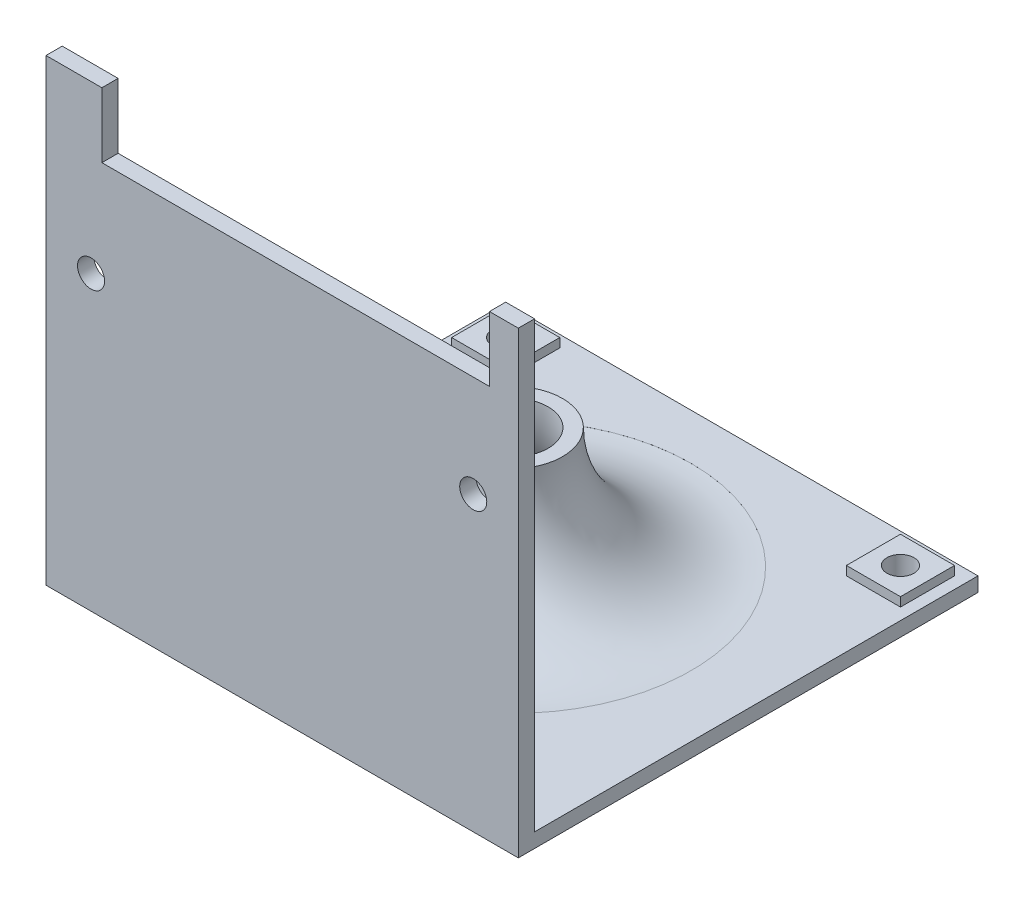
from build123d import *

# Parameters (mm, degrees)
SKETCH2_W           = 52.4
SKETCH2_H           = 51
SKETCH2_R           = 19.896881497
BOSS_EXTRUDE1_DEPTH = 1.6
SKETCH3_W           = 52.4
SKETCH3_H           = 1.8
BOSS_EXTRUDE2_DEPTH = 49.3
SKETCH4_W           = 6
SKETCH4_H           = 6
BOSS_EXTRUDE3_DEPTH = 1
SKETCH5_R           = 1.5
CUT_EXTRUDE1_DEPTH  = 62.006393108
SKETCH6_R           = 1.5
SKETCH6_W           = 43
SKETCH6_H           = 7.2
CUT_EXTRUDE2_DEPTH  = 77.842045782


with BuildPart() as part:
    # Sketch1 → Revolve1 (revolve)
    with BuildSketch(Plane.XY, mode=Mode.PRIVATE) as revolve1_sk:
        with BuildLine():
            Line((4, 15), (5.6, 15))
            ThreePointArc((5.6, 15), (9.845065713, 5.201403427), (19.896881497, 1.596673597))
            Line((19.896881497, 1.596673597), (20, 0))
            ThreePointArc((20, 0), (8.750759907, 4.0341439), (4, 15))
        make_face()
    revolve(revolve1_sk.sketch.rotate(Axis((0, 0, 0), (0, 1, 0)), 90), axis=Axis((0, 0, 0), (0, 1, 0)))

    # Sketch2 → Boss-Extrude1 (add)
    with BuildSketch(Plane(origin=(0, 0, 0), x_dir=(1, 0, 0), z_dir=(0, 1, 0))):
        with Locations((0.5, -0.5)):
            Rectangle(SKETCH2_W, SKETCH2_H)
        with Locations(Location((0, 0, 0), (0, 0, 90))):
            Circle(SKETCH2_R, mode=Mode.SUBTRACT)
    extrude(amount=BOSS_EXTRUDE1_DEPTH)

    # Sketch3 → Boss-Extrude2 (add)
    with BuildSketch(Plane(origin=(0, 1.6, 0), x_dir=(1, 0, 0), z_dir=(0, 1, 0))):
        with Locations((0.5, -25.1)):
            Rectangle(SKETCH3_W, SKETCH3_H)
    extrude(amount=BOSS_EXTRUDE2_DEPTH)

    # Sketch4 → Boss-Extrude3 (add)
    with BuildSketch(Plane(origin=(0, 1.6, 0), x_dir=(1, 0, 0), z_dir=(0, 1, 0))):
        with Locations((22.4, 20.7)):
            Rectangle(SKETCH4_W, SKETCH4_H)
        with Locations((-21.4, 20.7)):
            Rectangle(SKETCH4_W, SKETCH4_H)
    extrude(amount=BOSS_EXTRUDE3_DEPTH)

    # Sketch5 → Cut-Extrude1 (cut, through all)
    with BuildSketch(Plane(origin=(0, 2.6, 0), x_dir=(1, 0, 0), z_dir=(0, 1, 0))):
        with Locations(Location((22.4, 20.7, 0), (0, 0, 270))):
            Circle(SKETCH5_R)
        with Locations(Location((-21.4, 20.7, 0), (0, 0, 270))):
            Circle(SKETCH5_R)
    extrude(amount=-CUT_EXTRUDE1_DEPTH, mode=Mode.SUBTRACT)

    # Sketch6 → Cut-Extrude2 (cut, through all)
    with BuildSketch(Plane.XY.offset(26)):
        with Locations((-20.7, 32.45)):
            Circle(SKETCH6_R)
        with Locations((21.7, 32.45)):
            Circle(SKETCH6_R)
        with Locations((2, 47.3)):
            Rectangle(SKETCH6_W, SKETCH6_H)
    extrude(amount=-CUT_EXTRUDE2_DEPTH, mode=Mode.SUBTRACT)


solid = part.part
